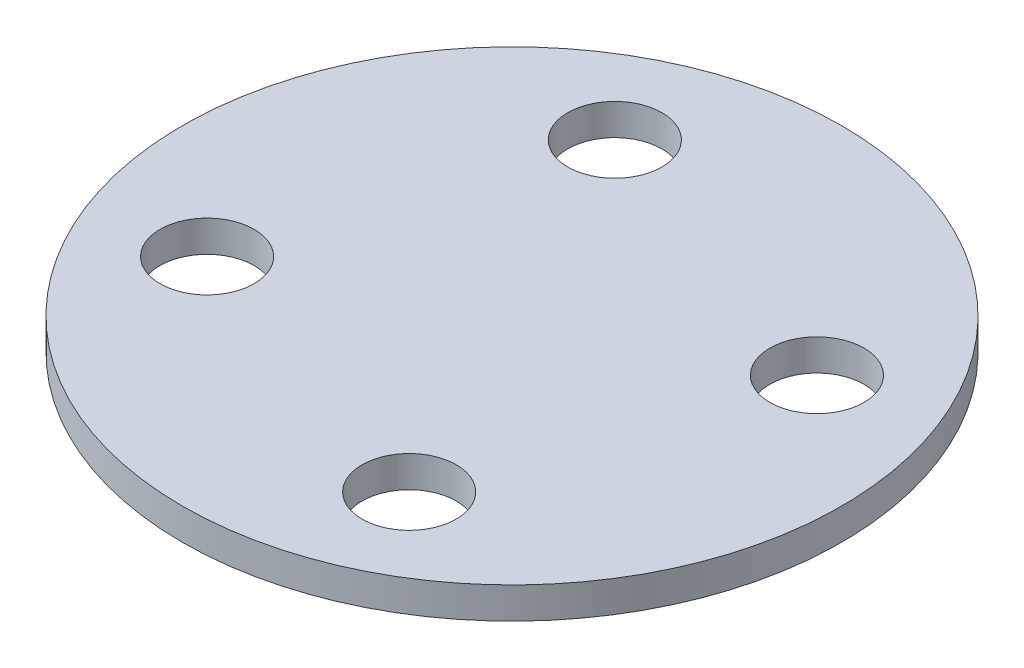
from build123d import *

# Parameters (mm, degrees)
SKETCH1_R           = 10.5
BOSS_EXTRUDE1_DEPTH = 1
SKETCH4_R           = 1.5
CUT_EXTRUDE1_DEPTH  = 15.882876066


with BuildPart() as part:
    # Sketch1 → Boss-Extrude1 (new body)
    with BuildSketch(Plane(origin=(0, 0, 0), x_dir=(1, 0, 0), z_dir=(0, 1, 0))):
        with Locations(Location((0, 0, 0), (0, 0, 270))):
            Circle(SKETCH1_R)
    extrude(amount=BOSS_EXTRUDE1_DEPTH)

    # Sketch4 → Cut-Extrude1 (cut, through all)
    with BuildSketch(Plane.XZ):
        with Locations(Location((6.495876564, -3.219640923, 0), (0, 0, 270))):
            Circle(SKETCH4_R)
        with Locations(Location((-3.219640923, -6.495876564, 0), (0, 0, 270))):
            Circle(SKETCH4_R)
        with Locations(Location((3.219640923, 6.495876564, 0), (0, 0, 270))):
            Circle(SKETCH4_R)
        with Locations(Location((-6.495876564, 3.219640923, 0), (0, 0, 270))):
            Circle(SKETCH4_R)
    extrude(amount=-CUT_EXTRUDE1_DEPTH, mode=Mode.SUBTRACT)


solid = part.part
